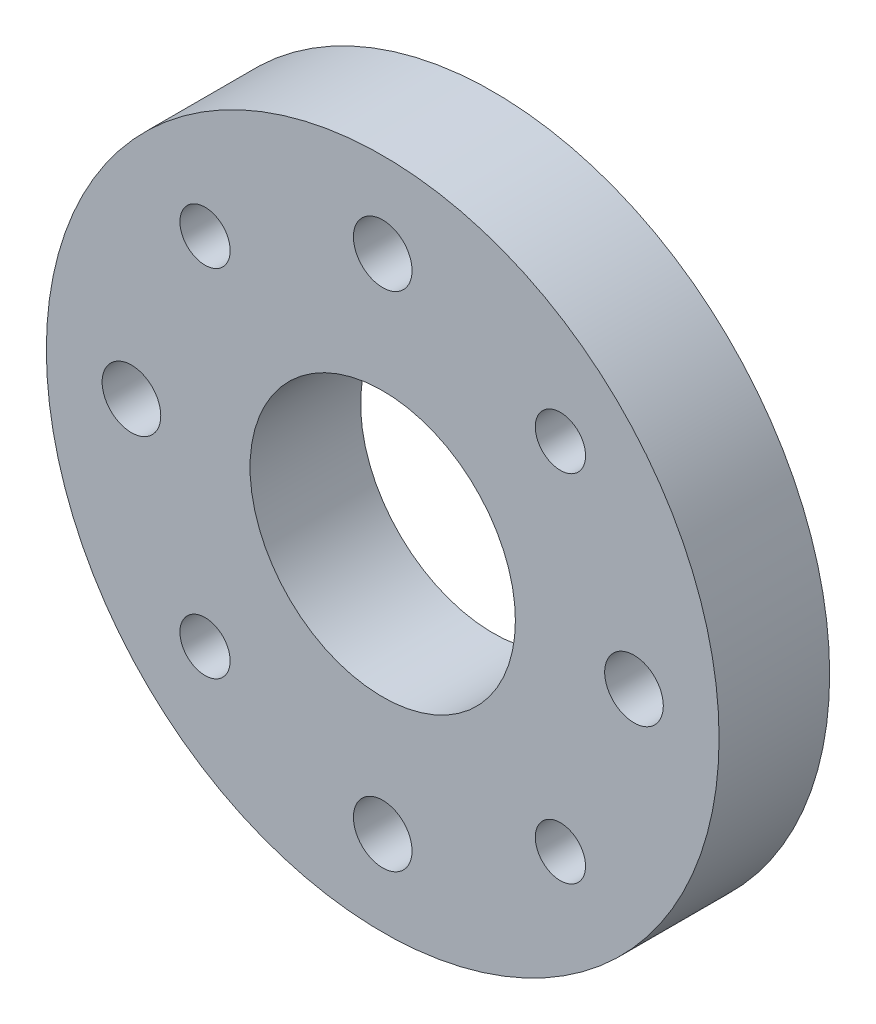
from build123d import *

# Parameters (mm, degrees)
SKETCH1_R           = 20
SKETCH1_R_2         = 8
SKETCH1_R_3         = 1.75
SKETCH1_R_4         = 1.5
BOSS_EXTRUDE1_DEPTH = 6.6
MOVE_FACE1_BY       = 0.08
MOVE_FACE1_2_BY     = 0.08


with BuildPart() as part:
    # Sketch1 → Boss-Extrude1 (new body)
    with BuildSketch(Plane.XY):
        Circle(SKETCH1_R)
        Circle(SKETCH1_R_2, mode=Mode.SUBTRACT)
        with Locations((0, 15)):
            Circle(SKETCH1_R_3, mode=Mode.SUBTRACT)
        with Locations((10.606601718, 10.606601718)):
            Circle(SKETCH1_R_4, mode=Mode.SUBTRACT)
        with Locations((15, 0)):
            Circle(SKETCH1_R_3, mode=Mode.SUBTRACT)
        with Locations((10.606601718, -10.606601718)):
            Circle(SKETCH1_R_4, mode=Mode.SUBTRACT)
        with Locations((0, -15)):
            Circle(SKETCH1_R_3, mode=Mode.SUBTRACT)
        with Locations((-10.606601718, -10.606601718)):
            Circle(SKETCH1_R_4, mode=Mode.SUBTRACT)
        with Locations((-15, 0)):
            Circle(SKETCH1_R_3, mode=Mode.SUBTRACT)
        with Locations((-10.606601718, 10.606601718)):
            Circle(SKETCH1_R_4, mode=Mode.SUBTRACT)
    extrude(amount=BOSS_EXTRUDE1_DEPTH)

    # Move Face1: a curved face moved outward by 0.08
    add(Solid.thicken(part.faces().sort_by_distance((-8, 0, 3.3))[0], MOVE_FACE1_BY))

    # Move Face1 2: a curved face moved outward by 0.08
    add(Solid.thicken(part.faces().sort_by_distance((-20, 0, 3.3))[0], MOVE_FACE1_2_BY))


solid = part.part
